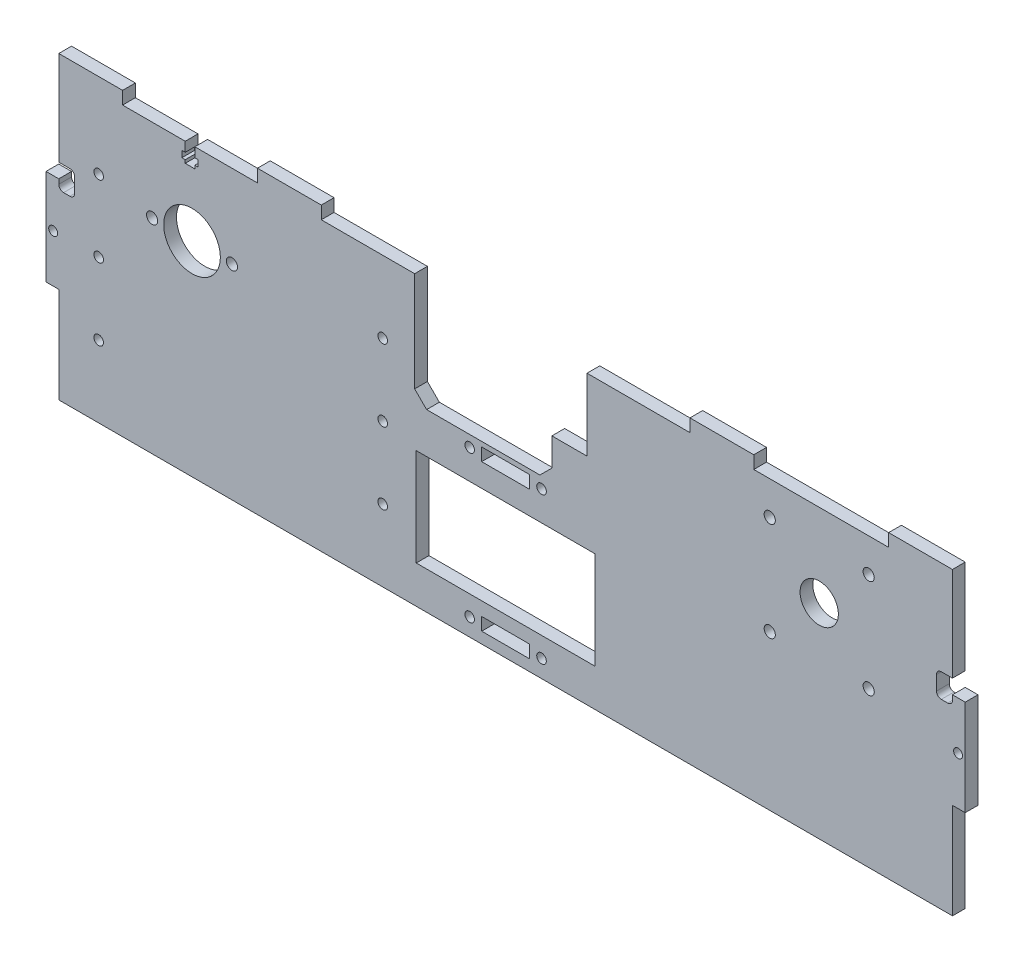
from build123d import *

# Parameters (mm, degrees)
SKETCH_1_W          = 280
SKETCH_1_H          = 90
SKETCH_1_R          = 1.5
SKETCH_1_R_2        = 1.75
SKETCH_1_R_3        = 6
SKETCH_1_R_4        = 8.875
SKETCH_1_W_2        = 15
SKETCH_1_H_2        = 4
SKETCH_1_W_3        = 56
SKETCH_1_H_3        = 30.5
EXTRUDE_1_DEPTH     = 4
SKETCH_2_W          = 20
SKETCH_2_H          = 4
SKETCH_2_W_2        = 4
SKETCH_2_H_2        = 30
SKETCH_2_R          = 1.4
EXTRUDE_2_DEPTH     = 4
SKETCH_3_W          = 5
SKETCH_3_H          = 7.5
CUT_EXTRUDE_1_DEPTH = 153.161098839
FILLET_1_R          = 1.5


with BuildPart() as part:
    # Эскиз1 → Бобышка-Вытянуть1 (new body)
    with BuildSketch(Plane.XY):
        Rectangle(SKETCH_1_W, SKETCH_1_H)
        with Locations((11.25, 6.5)):
            Circle(SKETCH_1_R, mode=Mode.SUBTRACT)
        with Locations((-11.25, 6.5)):
            Circle(SKETCH_1_R, mode=Mode.SUBTRACT)
        with Locations((-11.25, -39.5)):
            Circle(SKETCH_1_R, mode=Mode.SUBTRACT)
        with Locations((11.25, -39.5)):
            Circle(SKETCH_1_R, mode=Mode.SUBTRACT)
        with Locations((113.75, 34.5)):
            Circle(SKETCH_1_R_2, mode=Mode.SUBTRACT)
        with Locations((98.25, 19)):
            Circle(SKETCH_1_R_3, mode=Mode.SUBTRACT)
        with Locations((-98.25, 19)):
            Circle(SKETCH_1_R_4, mode=Mode.SUBTRACT)
        with Locations((113.75, 3.5)):
            Circle(SKETCH_1_R_2, mode=Mode.SUBTRACT)
        with Locations((82.75, 3.5)):
            Circle(SKETCH_1_R_2, mode=Mode.SUBTRACT)
        with Locations((82.75, 34.5)):
            Circle(SKETCH_1_R_2, mode=Mode.SUBTRACT)
        with Locations((-110.75, 19)):
            Circle(SKETCH_1_R_2, mode=Mode.SUBTRACT)
        with Locations((-85.75, 19)):
            Circle(SKETCH_1_R_2, mode=Mode.SUBTRACT)
        with Locations((-127.5, 22.5)):
            Circle(SKETCH_1_R, mode=Mode.SUBTRACT)
        with Locations((-127.5, 0)):
            Circle(SKETCH_1_R, mode=Mode.SUBTRACT)
        with Locations((-127.5, -22.5)):
            Circle(SKETCH_1_R, mode=Mode.SUBTRACT)
        with Locations((-38.5, 22.5)):
            Circle(SKETCH_1_R, mode=Mode.SUBTRACT)
        with Locations((-38.5, 0)):
            Circle(SKETCH_1_R, mode=Mode.SUBTRACT)
        with Locations((-38.5, -22.5)):
            Circle(SKETCH_1_R, mode=Mode.SUBTRACT)
        with Locations((0, -39.5)):
            Rectangle(SKETCH_1_W_2, SKETCH_1_H_2, mode=Mode.SUBTRACT)
        with Locations((0, 6.5)):
            Rectangle(SKETCH_1_W_2, SKETCH_1_H_2, mode=Mode.SUBTRACT)
        with Locations((0, -18)):
            Rectangle(SKETCH_1_W_3, SKETCH_1_H_3, mode=Mode.SUBTRACT)
    extrude(amount=EXTRUDE_1_DEPTH)

    # Эскиз2 → Бобышка-Вытянуть2 (add, through all)
    # profile 1 of 6: a face of its own
    with BuildSketch(Plane.XY.offset(4)):
        with Locations((130, 47)):
            Rectangle(SKETCH_2_W, SKETCH_2_H)
    # profile 2 of 6: a face of its own
    with BuildSketch(Plane.XY.offset(4)):
        with Locations((142, 0)):
            Rectangle(SKETCH_2_W_2, SKETCH_2_H_2)
        with Locations((141.75, 0)):
            Circle(SKETCH_2_R, mode=Mode.SUBTRACT)
    # profile 3 of 6: a face of its own
    with BuildSketch(Plane.XY.offset(4)):
        with Locations((-130, 47)):
            Rectangle(SKETCH_2_W, SKETCH_2_H)
    # profile 4 of 6: a face of its own
    with BuildSketch(Plane.XY.offset(4)):
        with Locations((-142, 0)):
            Rectangle(SKETCH_2_W_2, SKETCH_2_H_2)
        with Locations((-141.75, 0)):
            Circle(SKETCH_2_R, mode=Mode.SUBTRACT)
    # profile 5 of 6: a face of its own
    with BuildSketch(Plane.XY.offset(4)):
        with Locations((67.75, 47)):
            Rectangle(SKETCH_2_W, SKETCH_2_H)
    # profile 6 of 6: a face of its own
    with BuildSketch(Plane.XY.offset(4)):
        with Locations((-67.75, 47)):
            Rectangle(SKETCH_2_W, SKETCH_2_H)
    extrude(amount=-EXTRUDE_2_DEPTH)

    # Эскиз3 → Вырез-Вытянуть1 (cut, through all)
    with BuildSketch(Plane.XY.offset(4)):
        Polygon((14.5, 45), (14.5, 49), (-20.75, 49), (-20.75, 45), (-28.5, 45), (-28.5, 13.75), (-24.75, 10), (10.75, 10), (14.5, 13.75), (14.5, 22.5), (25.5, 22.5), (25.5, 45), align=None)
        Polygon((-97.375, 42), (-97.375, 45), (-100.375, 45), (-100.375, 42), (-101.425, 42), (-101.425, 40), (-100.375, 40), (-100.375, 39), (-97.375, 39), (-97.375, 40), (-96.325, 40), (-96.325, 42), align=None)
        with Locations((137.5, 15.75)):
            Rectangle(SKETCH_3_W, SKETCH_3_H)
        with Locations((-137.5, 15.75)):
            Rectangle(SKETCH_3_W, SKETCH_3_H)
    extrude(amount=-CUT_EXTRUDE_1_DEPTH, mode=Mode.SUBTRACT)

    # Скругление1
    fillet_1_edges = [part.edges().sort_by_distance(p)[0] for p in [
        (140, 12, 2),
        (135, 12, 2),
        (135, 19.5, 2),
        (-135, 12, 2),
        (-140, 12, 2),
        (-135, 19.5, 2),
    ]]
    fillet(fillet_1_edges, radius=FILLET_1_R)


solid = part.part
